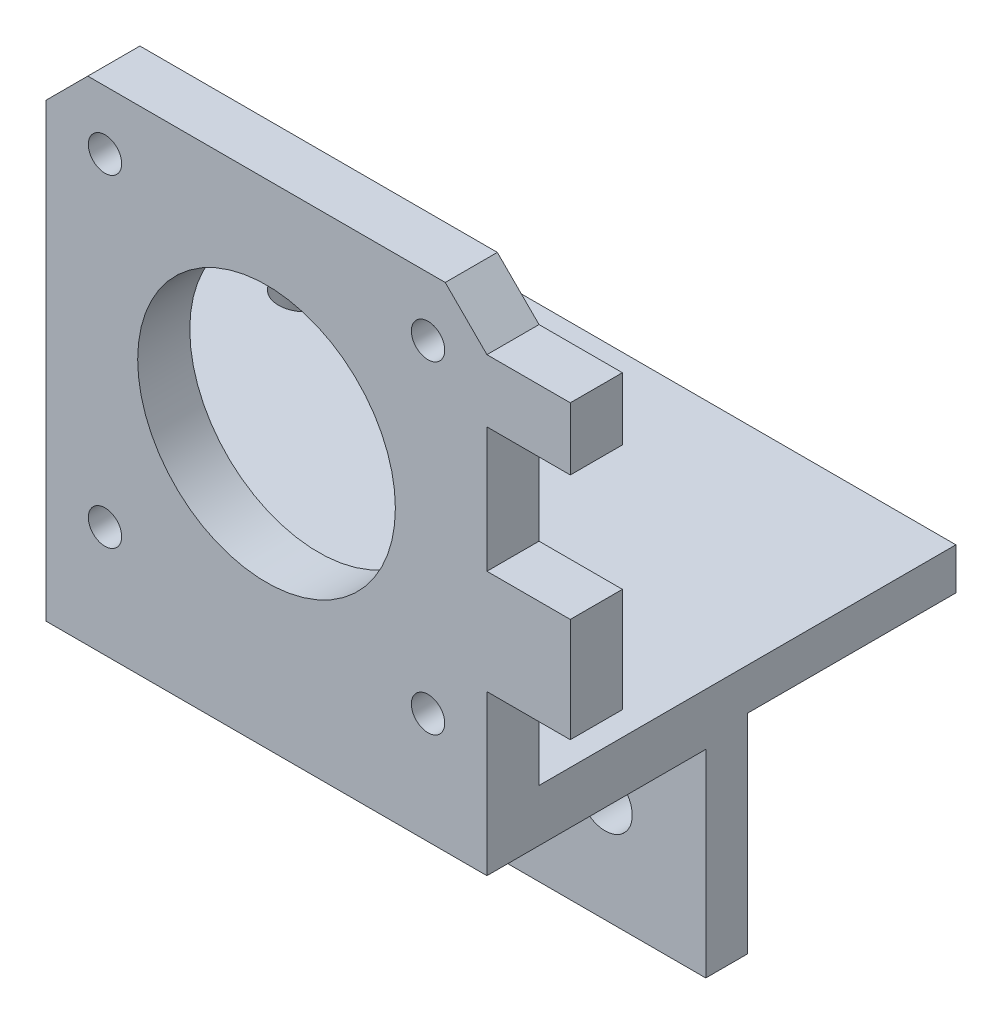
from build123d import *

# Parameters (mm, degrees)
SKICA1_W                 = 62.391596743
SKICA1_H                 = 24
P_IDAT_VYSUNUT_M1_DEPTH  = 4
SKICA2_W                 = 42.3
SKICA2_H                 = 5
P_IDAT_VYSUNUT_M2_DEPTH  = 16
SKICA3_R                 = 1.6
SKICA3_R_2               = 12.36434098
P_IDAT_VYSUNUT_M5_DEPTH  = 5
ZKOSEN_1_SIZE            = 16
SKICA4_R                 = 2.6
ODEBRAT_VYSUNUT_M1_DEPTH = 4
SKICA5_W                 = 62.391596743
SKICA5_H                 = 4
P_IDAT_VYSUNUT_M6_DEPTH  = 20
SKICA6_R                 = 2.6
ODEBRAT_VYSUNUT_M2_DEPTH = 4
SKICA7_W                 = 5
SKICA7_H                 = 6
SKICA7_H_2               = 10
P_IDAT_VYSUNUT_M7_DEPTH  = 8


with BuildPart() as part:
    # Skica1 → Přidat vysunutím1 (new body)
    with BuildSketch(Plane.XY):
        with Locations((-71.195798372, -0.971059771)):
            Rectangle(SKICA1_W, SKICA1_H)
    extrude(amount=P_IDAT_VYSUNUT_M1_DEPTH)

    # Skica2 → Přidat vysunutím2 (add)
    with BuildSketch(Plane.XY.offset(4)):
        with Locations((-61.15, 8.528940229)):
            Rectangle(SKICA2_W, SKICA2_H)
    extrude(amount=P_IDAT_VYSUNUT_M2_DEPTH)

    # Skica3 → Přidat vysunutím5 (add)
    with BuildSketch(Plane.XY.offset(20)):
        Polygon((-40, 6.028940229), (-82.3, 6.028940229), (-82.3, 49.328940229), (-78.3, 53.328940229), (-44, 53.328940229), (-40, 49.328940229), align=None)
        with Locations((-45.65, 47.678940229)):
            Circle(SKICA3_R, mode=Mode.SUBTRACT)
        with Locations((-76.65, 47.678940229)):
            Circle(SKICA3_R, mode=Mode.SUBTRACT)
        with Locations((-76.65, 16.678940229)):
            Circle(SKICA3_R, mode=Mode.SUBTRACT)
        with Locations((-45.65, 16.678940229)):
            Circle(SKICA3_R, mode=Mode.SUBTRACT)
        with Locations((-61.15, 32.178940229)):
            Circle(SKICA3_R_2, mode=Mode.SUBTRACT)
    extrude(amount=P_IDAT_VYSUNUT_M5_DEPTH)

    # Zkosení1
    zkosen_1_edges = [part.edges().sort_by_distance(p)[0] for p in [
        (-82.3, 8.528940229, 4),
    ]]
    chamfer(zkosen_1_edges, length=ZKOSEN_1_SIZE)

    # Skica4 → Odebrat vysunutím1 (cut)
    with BuildSketch(Plane.XY.offset(4)):
        with Locations((-89.655606689, -2.971059771)):
            Circle(SKICA4_R)
        with Locations((-69.655606689, -2.971059771)):
            Circle(SKICA4_R)
        with Locations((-49.655606689, -2.971059771)):
            Circle(SKICA4_R)
    extrude(amount=-ODEBRAT_VYSUNUT_M1_DEPTH, mode=Mode.SUBTRACT)

    # Skica5 → Přidat vysunutím6 (add)
    with BuildSketch(Plane(origin=(0, 0, 0), x_dir=(-1, 0, 0), z_dir=(0, 0, -1))):
        with Locations((71.195798372, 9.028940229)):
            Rectangle(SKICA5_W, SKICA5_H)
    extrude(amount=P_IDAT_VYSUNUT_M6_DEPTH)

    # Skica6 → Odebrat vysunutím2 (cut)
    with BuildSketch(Plane(origin=(0, 11.028940229, 0), x_dir=(1, 0, 0), z_dir=(0, 1, 0))):
        with Locations(Location((-92.391596743, 10, 0), (0, 0, 270))):
            Circle(SKICA6_R)
    extrude(amount=-ODEBRAT_VYSUNUT_M2_DEPTH, mode=Mode.SUBTRACT)

    # Skica7 → Přidat vysunutím7 (add)
    with BuildSketch(Plane(origin=(-40, 0, 0), x_dir=(0, 0, -1), z_dir=(1, 0, 0))):
        with Locations((-22.5, 46.328940229)):
            Rectangle(SKICA7_W, SKICA7_H)
        with Locations((-22.5, 26.328940229)):
            Rectangle(SKICA7_W, SKICA7_H_2)
    extrude(amount=P_IDAT_VYSUNUT_M7_DEPTH)


solid = part.part
